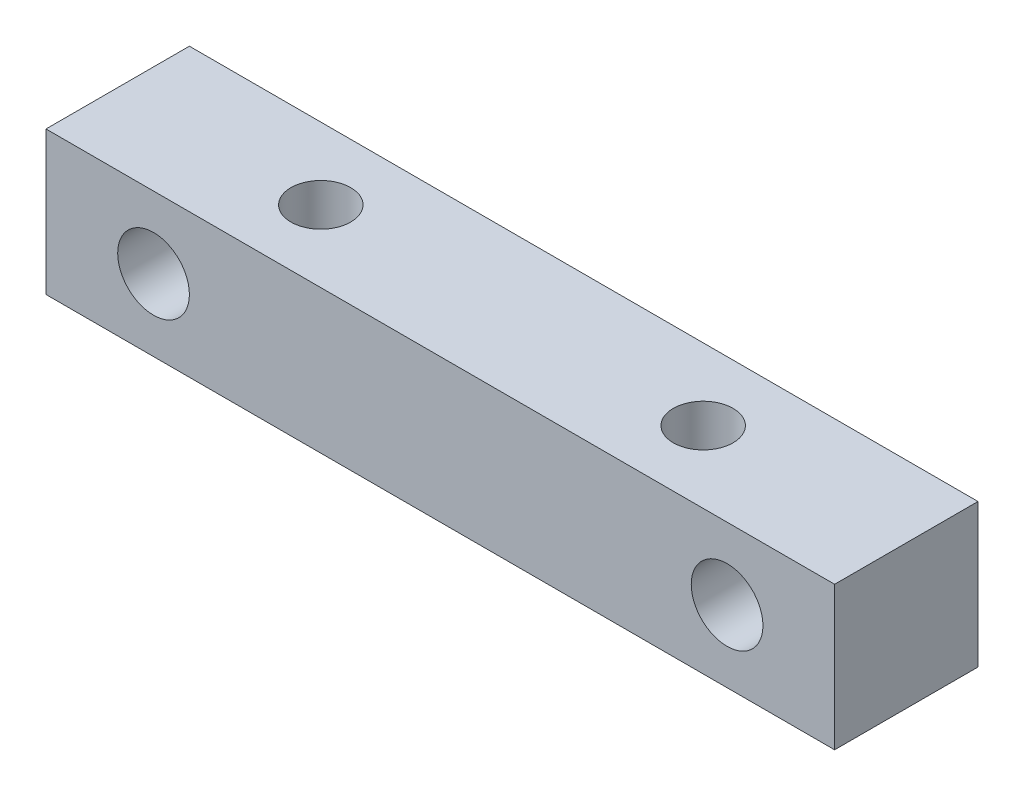
from build123d import *

# Parameters (mm, degrees)
SKETCH_1_W          = 53
SKETCH_1_H          = 38
SKETCH_1_W_2        = 45
SKETCH_1_H_2        = 30
EXTRUDE_1_DEPTH     = 6
SKETCH_2_R          = 1.5
CUT_EXTRUDE_1_DEPTH = 59
SKETCH_4_W          = 53
SKETCH_4_H          = 2
EXTRUDE_1_2_DEPTH   = 6
SKETCH_5_R          = 1.5
CUT_EXTRUDE_3_DEPTH = 59
SKETCH_11_W         = 53
SKETCH_11_H         = 4
CUT_EXTRUDE_5_DEPTH = 10
SKETCH_12_W         = 53
SKETCH_12_H         = 30
CUT_EXTRUDE_6_DEPTH = 10
SKETCH_13_R         = 1.25
CUT_EXTRUDE_7_DEPTH = 10
SKETCH_14_W         = 10
SKETCH_14_H         = 6
CUT_EXTRUDE_8_DEPTH = 10


with BuildPart() as part:
    # 草图1 → Extrude 1 (new body)
    with BuildSketch(Plane.XY):
        Rectangle(SKETCH_1_W, SKETCH_1_H)
        Rectangle(SKETCH_1_W_2, SKETCH_1_H_2, mode=Mode.SUBTRACT)
    extrude(amount=EXTRUDE_1_DEPTH)

    # 草图2 → 切除-拉伸1 (cut)
    with BuildSketch(Plane.ZY.offset(26.5)):
        with Locations((3.5, 9)):
            Circle(SKETCH_2_R)
        with Locations((3.5, -9)):
            Circle(SKETCH_2_R)
    extrude(amount=-CUT_EXTRUDE_1_DEPTH, mode=Mode.SUBTRACT)

    # 草图4 → Extrude 1 2 (add)
    with BuildSketch(Plane(origin=(0, 0, 0), x_dir=(-1, 0, 0), z_dir=(0, 0, -1))):
        with Locations((0, -20)):
            Rectangle(SKETCH_4_W, SKETCH_4_H)
    extrude(amount=-EXTRUDE_1_2_DEPTH)

    # 草图5 → 切除-拉伸3 (cut)
    with BuildSketch(Plane(origin=(0, 0, 0), x_dir=(-1, 0, 0), z_dir=(0, 0, -1))):
        with Locations((12, -18)):
            Circle(SKETCH_5_R)
        with Locations((-12, -18)):
            Circle(SKETCH_5_R)
    extrude(amount=-CUT_EXTRUDE_3_DEPTH, mode=Mode.SUBTRACT)

    # 草图11 → 切除-拉伸5 (cut)
    with BuildSketch(Plane.XY.offset(6)):
        with Locations((0, 17)):
            Rectangle(SKETCH_11_W, SKETCH_11_H)
    extrude(amount=-CUT_EXTRUDE_5_DEPTH, mode=Mode.SUBTRACT)

    # 草图12 → 切除-拉伸6 (cut)
    with BuildSketch(Plane.XY.offset(6)):
        Rectangle(SKETCH_12_W, SKETCH_12_H)
    extrude(amount=-CUT_EXTRUDE_6_DEPTH, mode=Mode.SUBTRACT)

    # 草图13 → 切除-拉伸7 (cut)
    with BuildSketch(Plane.XZ.offset(21)):
        with Locations(Location((8, 3, 0), (0, 0, 270))):
            Circle(SKETCH_13_R)
        with Locations(Location((-8, 3, 0), (0, 0, 270))):
            Circle(SKETCH_13_R)
    extrude(amount=-CUT_EXTRUDE_7_DEPTH, mode=Mode.SUBTRACT)

    # 草图14 → 切除-拉伸8 (cut)
    with BuildSketch(Plane(origin=(0, 0, 0), x_dir=(-1, 0, 0), z_dir=(0, 0, -1))):
        with Locations((21.5, -18)):
            Rectangle(SKETCH_14_W, SKETCH_14_H)
        with Locations((-21.5, -18)):
            Rectangle(SKETCH_14_W, SKETCH_14_H)
    extrude(amount=-CUT_EXTRUDE_8_DEPTH, mode=Mode.SUBTRACT)


solid = part.part
